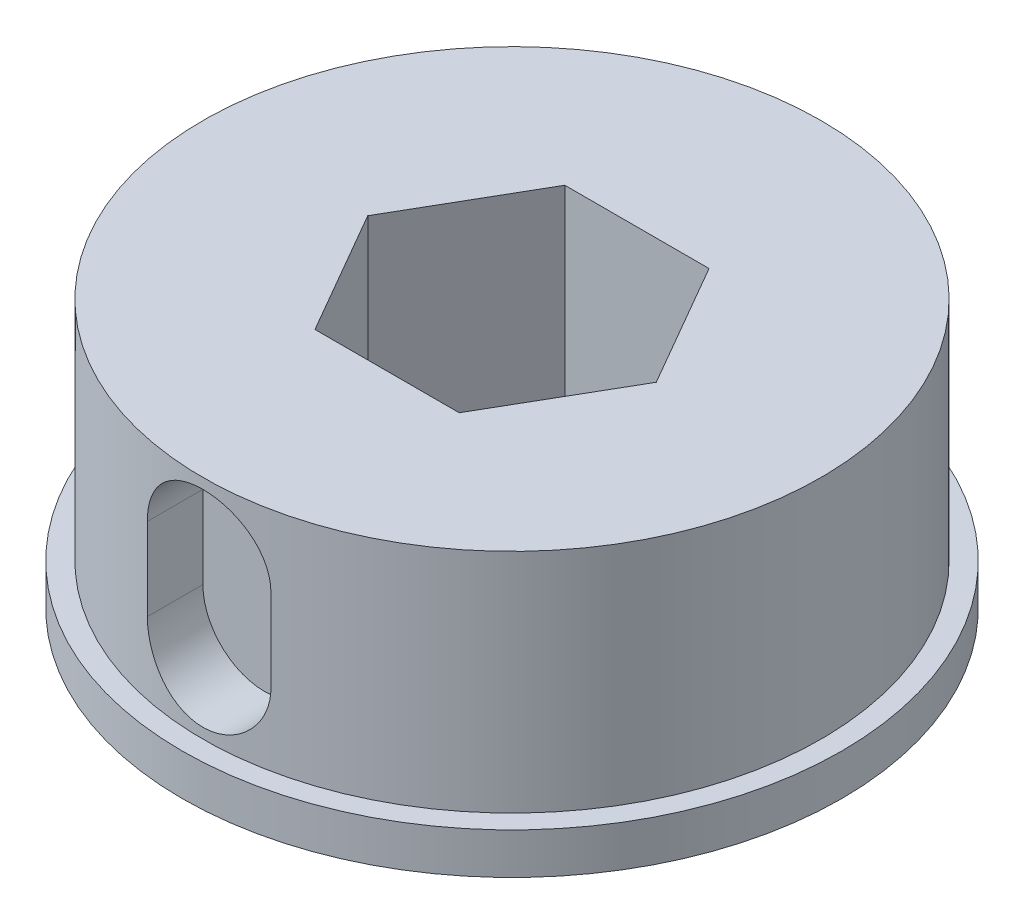
from build123d import *

# Parameters (mm, degrees)
CUT_EXTRUDE1_DEPTH = 27.095976701
CUT_EXTRUDE2_DEPTH = 3


with BuildPart() as part:
    # Sketch1 → Revolve2 (revolve)
    with BuildSketch(Plane.XY, mode=Mode.PRIVATE) as revolve2_sk:
        Polygon((0, 13), (15, 13), (15, 2), (16, 2), (16, 0), (0, 0), align=None)
    revolve(revolve2_sk.sketch.rotate(Axis((0, 0, 0), (0, 1, 0)), 90), axis=Axis((0, 0, 0), (0, 1, 0)))

    # Sketch2 → Cut-Extrude1 (cut, through all)
    with BuildSketch(Plane(origin=(0, 13, 0), x_dir=(1, 0, 0), z_dir=(0, 1, 0))):
        Polygon((-7, 0), (-3.5, -6.062177826), (3.5, -6.062177826), (7, 0), (3.5, 6.062177826), (-3.5, 6.062177826), align=None)
    extrude(amount=-CUT_EXTRUDE1_DEPTH, mode=Mode.SUBTRACT)

    # Sketch4 → Cut-Extrude2 (cut)
    with BuildSketch(Plane.XY.offset(15)):
        with BuildLine():
            Line((3, 9.5), (3, 5.5))
            ThreePointArc((3, 5.5), (0, 2.5), (-3, 5.5))
            Line((-3, 5.5), (-3, 9.5))
            ThreePointArc((-3, 9.5), (0, 12.5), (3, 9.5))
        make_face()
    extrude(amount=-CUT_EXTRUDE2_DEPTH, mode=Mode.SUBTRACT)


solid = part.part
